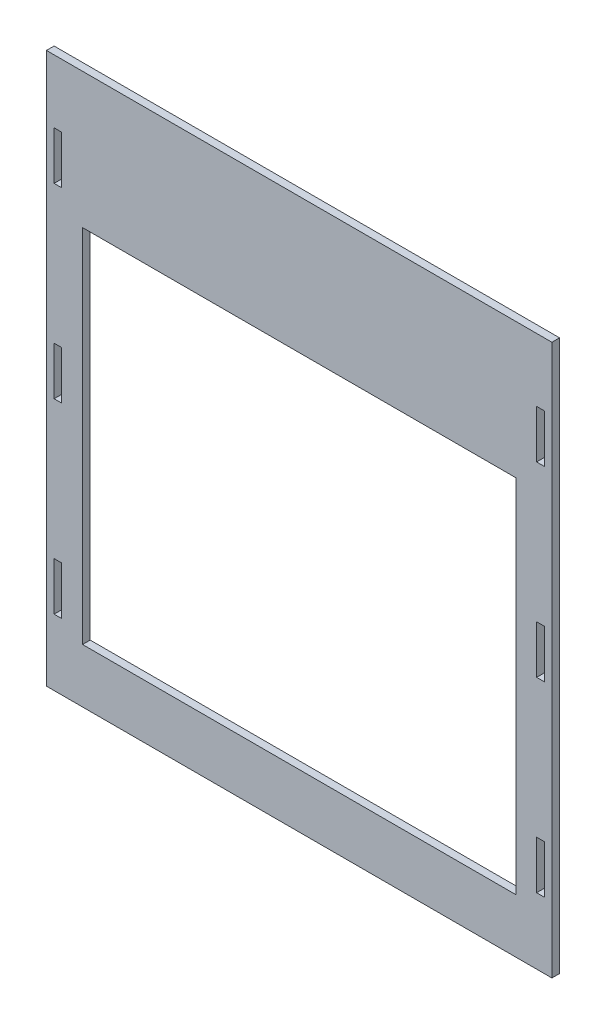
from build123d import *

# Parameters (mm, degrees)
SKETCH1_W           = 6.35
SKETCH1_H           = 40
SKETCH1_W_2         = 360
SKETCH1_H_2         = 300
BOSS_EXTRUDE1_DEPTH = 6.35


with BuildPart() as part:
    # Sketch1 → Boss-Extrude1 (new body)
    with BuildSketch(Plane.XY):
        Polygon((0, 0), (420, 0), (420, 457.5), (413.65, 457.5), (407.3, 457.5), (12.7, 457.5), (6.35, 457.5), (0, 457.5), align=None)
        with Locations((9.525, 385)):
            Rectangle(SKETCH1_W, SKETCH1_H, mode=Mode.SUBTRACT)
        with Locations((410.475, 385)):
            Rectangle(SKETCH1_W, SKETCH1_H, mode=Mode.SUBTRACT)
        with Locations((9.525, 230)):
            Rectangle(SKETCH1_W, SKETCH1_H, mode=Mode.SUBTRACT)
        with Locations((410.475, 230)):
            Rectangle(SKETCH1_W, SKETCH1_H, mode=Mode.SUBTRACT)
        with Locations((410.475, 75)):
            Rectangle(SKETCH1_W, SKETCH1_H, mode=Mode.SUBTRACT)
        with Locations((9.525, 75)):
            Rectangle(SKETCH1_W, SKETCH1_H, mode=Mode.SUBTRACT)
        with Locations((210, 195)):
            Rectangle(SKETCH1_W_2, SKETCH1_H_2, mode=Mode.SUBTRACT)
    extrude(amount=BOSS_EXTRUDE1_DEPTH)


solid = part.part
